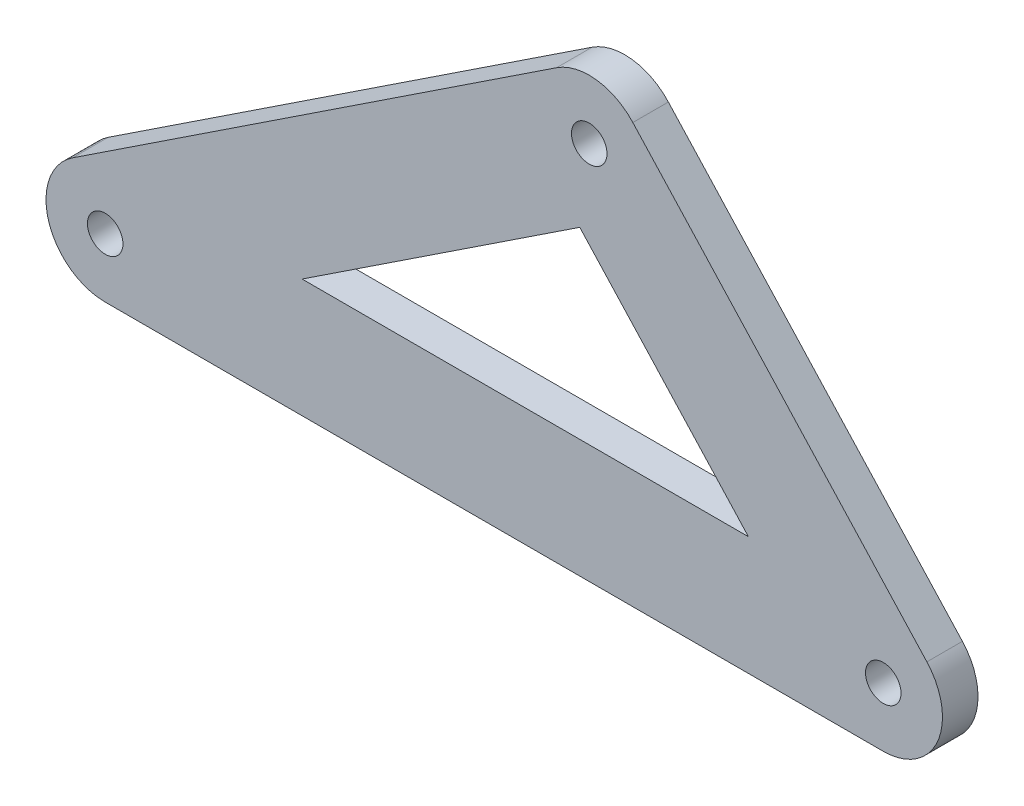
from build123d import *

# Parameters (mm, degrees)
SKETCH1_R           = 1.5
BOSS_EXTRUDE1_DEPTH = 3


with BuildPart() as part:
    # Sketch1 → Boss-Extrude1 (new body)
    with BuildSketch(Plane.XY):
        with BuildLine():
            Line((-2.757874024, 4.170627155), (38.114272094, 31.197792594))
            ThreePointArc((38.114272094, 31.197792594), (41.479478747, 31.990143081), (44.554321247, 30.409706839))
            Line((44.554321247, 30.409706839), (69.382175128, 3.382541401))
            ThreePointArc((69.382175128, 3.382541401), (70.277810995, -2.01088202), (65.7, -5))
            Line((65.7, -5), (0, -5))
            ThreePointArc((0, -5), (-4.788169576, -1.439941705), (-2.757874024, 4.170627155))
        make_face()
        with Locations((40.872146119, 27.027165439)):
            Circle(SKETCH1_R, mode=Mode.SUBTRACT)
        Circle(SKETCH1_R, mode=Mode.SUBTRACT)
        with Locations((65.7, 0)):
            Circle(SKETCH1_R, mode=Mode.SUBTRACT)
        Polygon((40.074023256, 20.505095423), (54.317405325, 5), (16.626261885, 5), align=None, mode=Mode.SUBTRACT)
    extrude(amount=BOSS_EXTRUDE1_DEPTH)


solid = part.part
